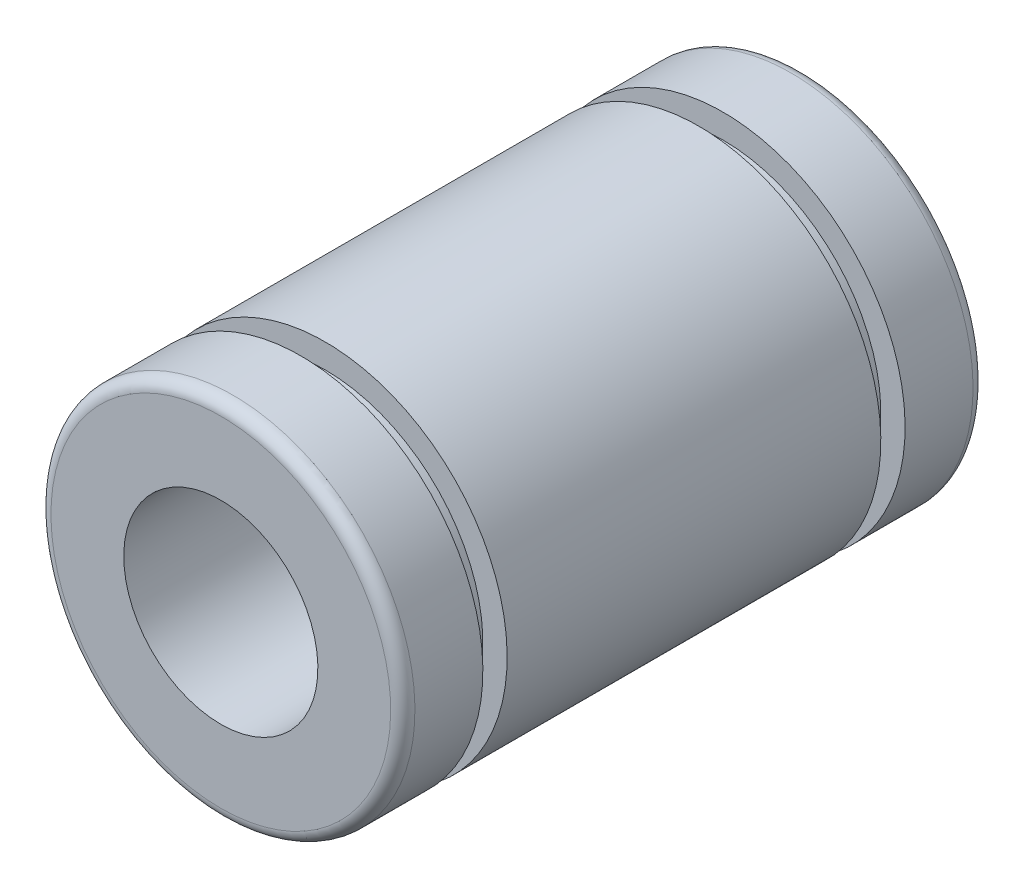
from build123d import *


with BuildPart() as part:
    # Эскиз2 → Повернуть1 (revolve)
    with BuildSketch(Plane(origin=(0, 0, 0), x_dir=(0, 0, -1), z_dir=(1, 0, 0))):
        with BuildLine():
            Line((7.7, -7.5), (7.7, -6.5))
            Line((7.7, -6.5), (8.7, -6.5))
            Line((8.7, -6.5), (8.7, -7.5))
            Line((8.7, -7.5), (11.5, -7.5))
            ThreePointArc((11.5, -7.5), (11.853553391, -7.353553391), (12, -7))
            Line((12, -7), (12, -4))
            Line((12, -4), (-12, -4))
            Line((-12, -4), (-12, -7))
            ThreePointArc((-12, -7), (-11.853553391, -7.353553391), (-11.5, -7.5))
            Line((-11.5, -7.5), (-8.7, -7.5))
            Line((-8.7, -7.5), (-8.7, -6.5))
            Line((-8.7, -6.5), (-7.7, -6.5))
            Line((-7.7, -6.5), (-7.7, -7.5))
            Line((-7.7, -7.5), (7.7, -7.5))
        make_face()
    revolve(axis=Axis((0, 0, 12), (0, 0, -1)))


solid = part.part
